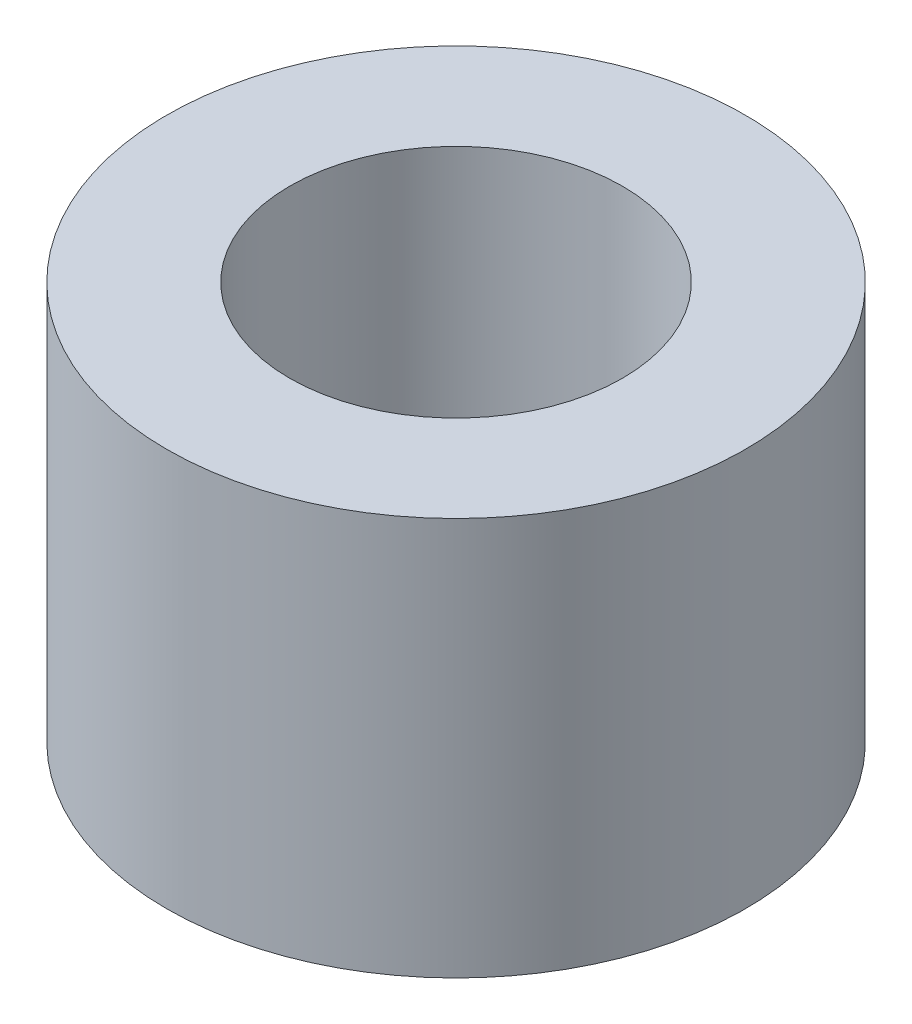
from build123d import *

# Parameters (mm, degrees)
SKETCH1_R           = 4
SKETCH1_R_2         = 2.3
BOSS_EXTRUDE1_DEPTH = 5.5


with BuildPart() as part:
    # Sketch1 → Boss-Extrude1 (new body)
    with BuildSketch(Plane(origin=(0, 0, 0), x_dir=(1, 0, 0), z_dir=(0, 1, 0))):
        with Locations(Location((-42.709797455, 13.245672102, 0), (0, 0, 270))):
            Circle(SKETCH1_R)
        with Locations(Location((-42.709797455, 13.245672102, 0), (0, 0, 270))):
            Circle(SKETCH1_R_2, mode=Mode.SUBTRACT)
    extrude(amount=BOSS_EXTRUDE1_DEPTH)


solid = part.part
